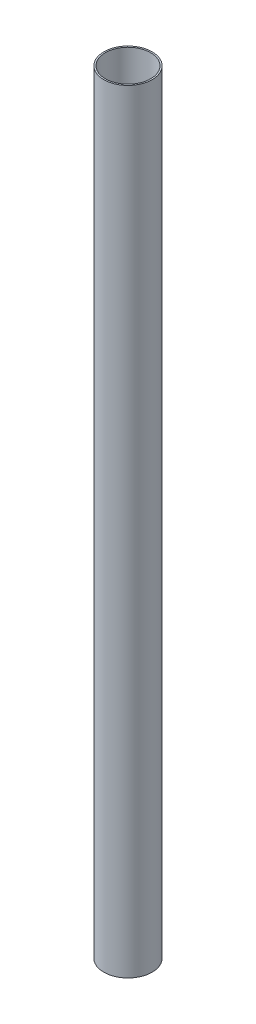
from build123d import *

# Parameters (mm, degrees)
SKETCH1_R           = 25.4
BOSS_EXTRUDE1_DEPTH = 406.4
SHELL1_T            = -1.5875


with BuildPart() as part:
    # Sketch1 → Boss-Extrude1 (new, symmetric)
    with BuildSketch(Plane(origin=(0, 0, 0), x_dir=(1, 0, 0), z_dir=(0, 1, 0))):
        with Locations(Location((0, 0, 0), (0, 0, 270))):
            Circle(SKETCH1_R)
    extrude(amount=BOSS_EXTRUDE1_DEPTH, both=True)

    # Shell1
    shell1_openings = [part.faces().sort_by_distance(p)[0] for p in [
        (0, 406.4, 0),
        (0, -406.4, 0),
    ]]
    offset(amount=SHELL1_T, openings=shell1_openings, kind=Kind.INTERSECTION)


solid = part.part
